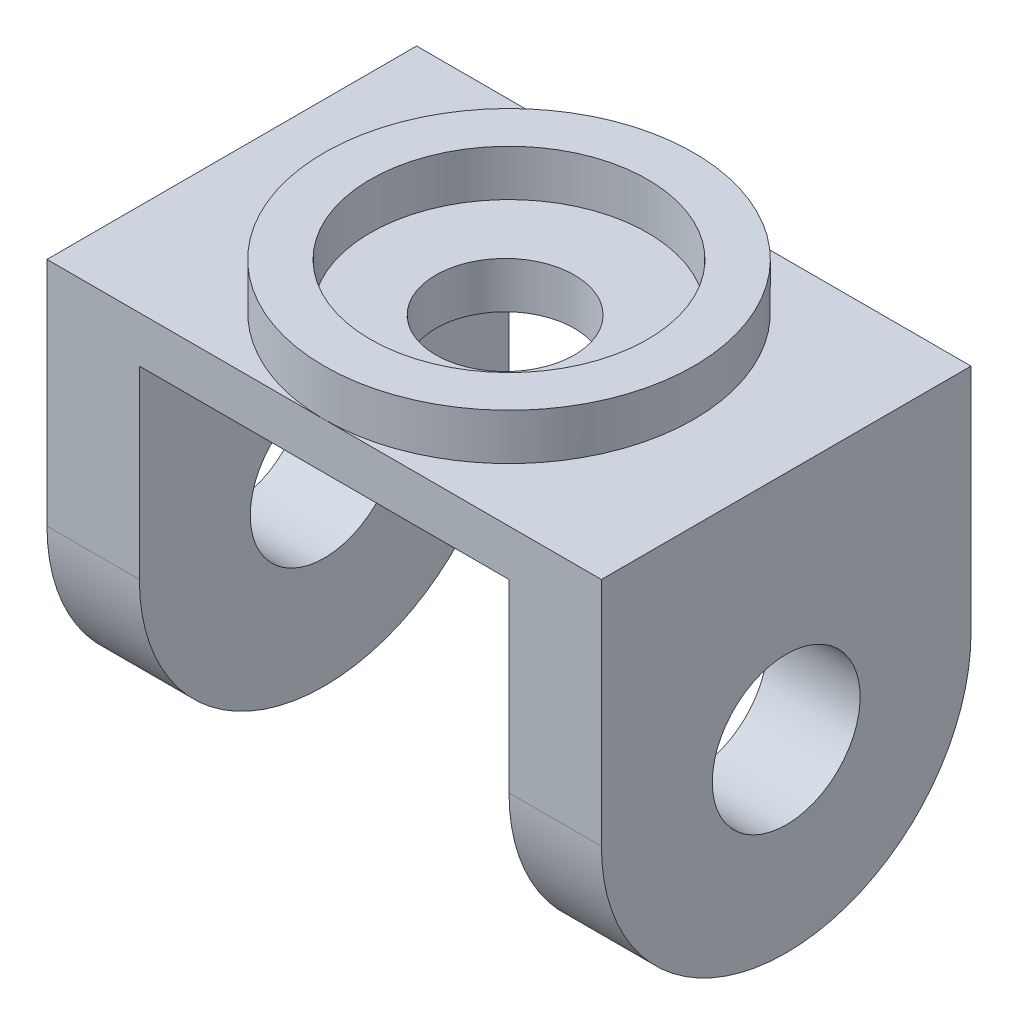
from build123d import *

# Parameters (mm, degrees)
SKETCH1_W                   = 120
SKETCH1_H                   = 80
BOSS_EXTRUDE1_DEPTH         = 10
SKETCH2_R                   = 40
SKETCH2_R_2                 = 30
BOSS_EXTRUDE2_DEPTH         = 20
SKETCH3_R                   = 15
CUT_EXTRUDE1_DEPTH          = 20
SKETCH4_W                   = 20
SKETCH4_H                   = 80
BOSS_EXTRUDE3_DEPTH         = 80
FILLET1_RADIUS              = 40
FILLET1_LENGTH              = 20
SKETCH5_R                   = 16
CUT_EXTRUDE3_DEPTH          = 150.666295471
FILLET1_OF_MIRROR5_2_RADIUS = 40
FILLET1_OF_MIRROR5_2_LENGTH = 20


with BuildPart() as part:
    # Sketch1 → Boss-Extrude1 (new body)
    with BuildSketch(Plane(origin=(0, 0, 0), x_dir=(1, 0, 0), z_dir=(0, 1, 0))):
        Rectangle(SKETCH1_W, SKETCH1_H)
    extrude(amount=BOSS_EXTRUDE1_DEPTH)

    # Sketch2 → Boss-Extrude2 (add)
    with BuildSketch(Plane(origin=(0, 0, 0), x_dir=(1, 0, 0), z_dir=(0, 1, 0))):
        with Locations(Location((0, 0, 0), (0, 0, 270))):
            Circle(SKETCH2_R)
        with Locations(Location((0, 0, 0), (0, 0, 270))):
            Circle(SKETCH2_R_2, mode=Mode.SUBTRACT)
    extrude(amount=BOSS_EXTRUDE2_DEPTH)

    # Sketch3 → Cut-Extrude1 (cut)
    with BuildSketch(Plane(origin=(0, 10, 0), x_dir=(1, 0, 0), z_dir=(0, 1, 0))):
        with Locations(Location((0, -0.840544131, 0), (0, 0, 270))):
            Circle(SKETCH3_R)
    extrude(amount=-CUT_EXTRUDE1_DEPTH, mode=Mode.SUBTRACT)

    # Sketch4 → Boss-Extrude3 (add)
    with BuildSketch(Plane.XZ):
        with Locations((-50, 0)):
            Rectangle(SKETCH4_W, SKETCH4_H)
    boss_extrude3 = extrude(amount=BOSS_EXTRUDE3_DEPTH)

    # Fillet1: full round fillet: the end face becomes a half cylinder, R = half its width
    fillet1_face = Plane((-50, -80, 0), x_dir=(1, 0, 0), z_dir=(0, -1, 0))  # on the end face: x along it, z out of the body
    fillet1_slab = fillet1_face.offset(-FILLET1_RADIUS / 2) * Box(FILLET1_LENGTH, 2 * FILLET1_RADIUS, FILLET1_RADIUS, mode=Mode.PRIVATE)  # the body's end, R deep
    fillet1_round = Plane((-50, -40, 0), x_dir=(0, -1, 0), z_dir=(1, 0, 0)) * Cylinder(FILLET1_RADIUS, FILLET1_LENGTH, mode=Mode.PRIVATE)  # its axis R under the face
    add(fillet1_slab - fillet1_round, mode=Mode.SUBTRACT)

    # Sketch5 → Cut-Extrude3 (cut, through all)
    with BuildSketch(Plane.ZY.offset(60)):
        with Locations((0, -40)):
            Circle(SKETCH5_R)
    cut_extrude3 = extrude(amount=-CUT_EXTRUDE3_DEPTH, mode=Mode.SUBTRACT)

    # Mirror5: Boss-Extrude3 across plane
    add(boss_extrude3.mirror(Plane(origin=(0, 0, 0), x_dir=(0, 0, 1), z_dir=(1, 0, 0))))

    # Fillet1 of Mirror5 2: full round fillet: the end face becomes a half cylinder, R = half its width
    fillet1_of_mirror5_2_face = Plane((50, -80, 0), x_dir=(-1, 0, 0), z_dir=(0, -1, 0))  # on the end face: x along it, z out of the body
    fillet1_of_mirror5_2_slab = fillet1_of_mirror5_2_face.offset(-FILLET1_OF_MIRROR5_2_RADIUS / 2) * Box(FILLET1_OF_MIRROR5_2_LENGTH, 2 * FILLET1_OF_MIRROR5_2_RADIUS, FILLET1_OF_MIRROR5_2_RADIUS, mode=Mode.PRIVATE)  # the body's end, R deep
    fillet1_of_mirror5_2_round = Plane((50, -40, 0), x_dir=(0, -1, 0), z_dir=(-1, 0, 0)) * Cylinder(FILLET1_OF_MIRROR5_2_RADIUS, FILLET1_OF_MIRROR5_2_LENGTH, mode=Mode.PRIVATE)  # its axis R under the face
    add(fillet1_of_mirror5_2_slab - fillet1_of_mirror5_2_round, mode=Mode.SUBTRACT)

    # Mirror6: Cut-Extrude3 across plane
    add(cut_extrude3.mirror(Plane(origin=(0, 0, 0), x_dir=(0, 0, 1), z_dir=(1, 0, 0))), mode=Mode.SUBTRACT)


solid = part.part
